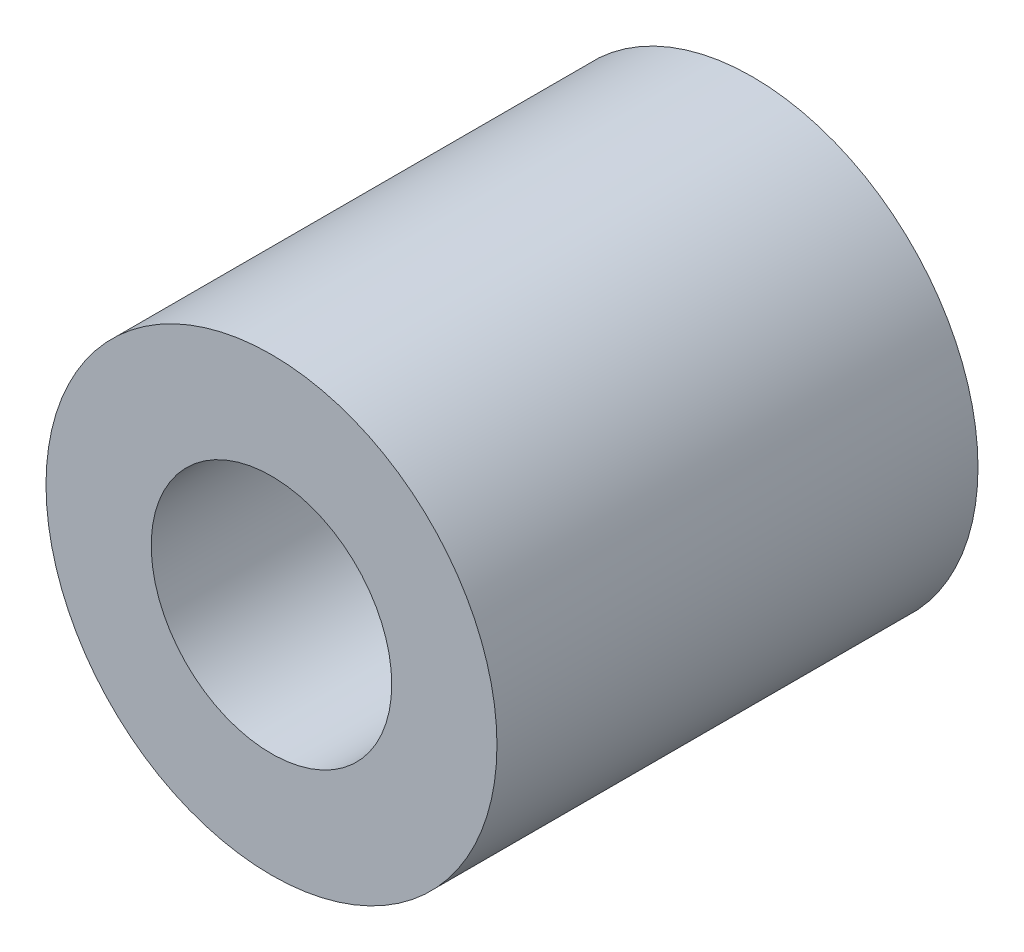
from build123d import *

# Parameters (mm, degrees)
SKETCH_1_R      = 7.5
SKETCH_1_R_2    = 4
EXTRUDE_1_DEPTH = 16


with BuildPart() as part:
    # 草图1 → 凸台-拉伸1 (new body)
    with BuildSketch(Plane.XY):
        Circle(SKETCH_1_R)
        Circle(SKETCH_1_R_2, mode=Mode.SUBTRACT)
    extrude(amount=EXTRUDE_1_DEPTH)


solid = part.part
